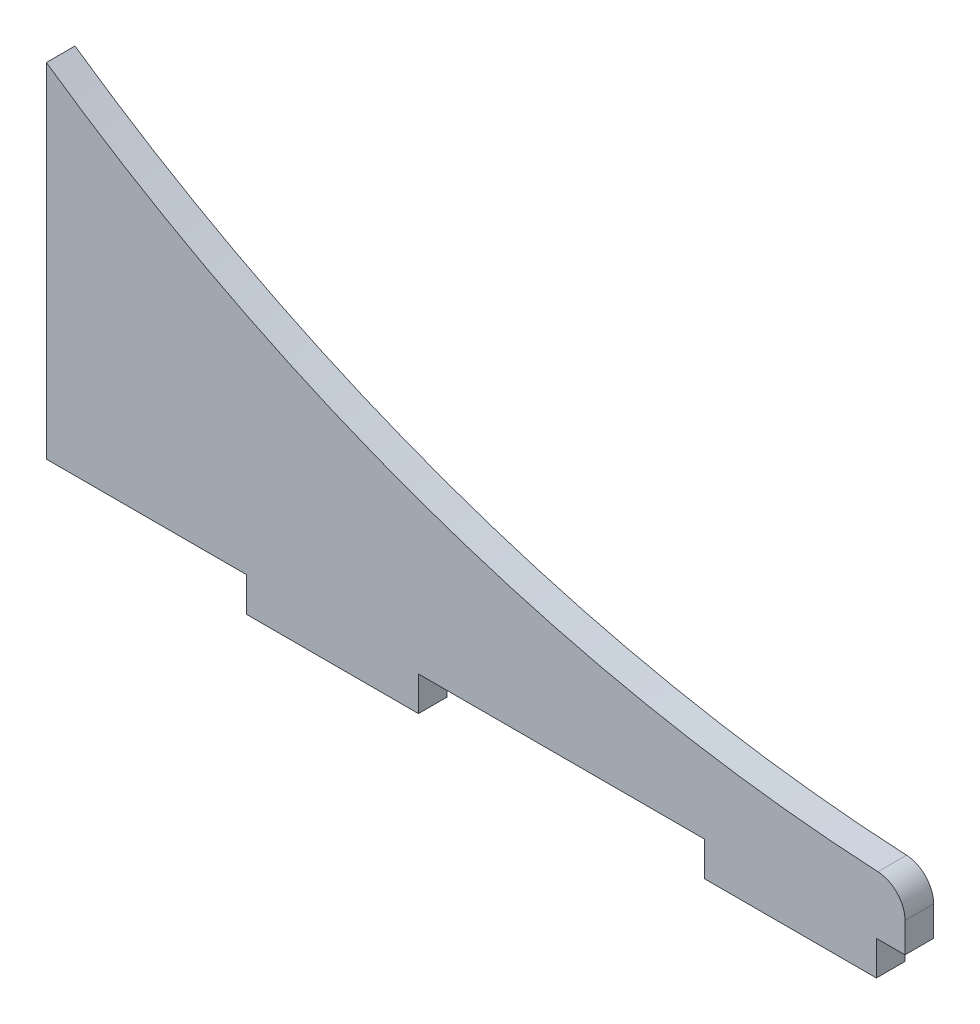
from build123d import *

# Parameters (mm, degrees)
EXTRUDE_1_DEPTH = 5
FILLET_1_R      = 5


with BuildPart() as part:
    # 草图1 → 凸台-拉伸1 (new body)
    with BuildSketch(Plane.XY):
        with BuildLine():
            Line((125, 0), (125, -6))
            Line((125, -6), (95, -6))
            Line((95, -6), (95, 0))
            Line((95, 0), (45, 0))
            Line((45, 0), (45, -6))
            Line((45, -6), (15, -6))
            Line((15, -6), (15, 0))
            Line((15, 0), (0, 0))
            Line((0, 0), (-20, 0))
            Line((-20, 0), (-20, 60))
            ThreePointArc((-20, 60), (51.397381618, 24.192144853), (130, 10))
            Line((130, 10), (130, 0))
            Line((130, 0), (125, 0))
        make_face()
    extrude(amount=EXTRUDE_1_DEPTH)

    # 圆角1
    fillet_1_edges = [part.edges().sort_by_distance(p)[0] for p in [
        (130, 10, 2.5),
    ]]
    fillet(fillet_1_edges, radius=FILLET_1_R)


solid = part.part
